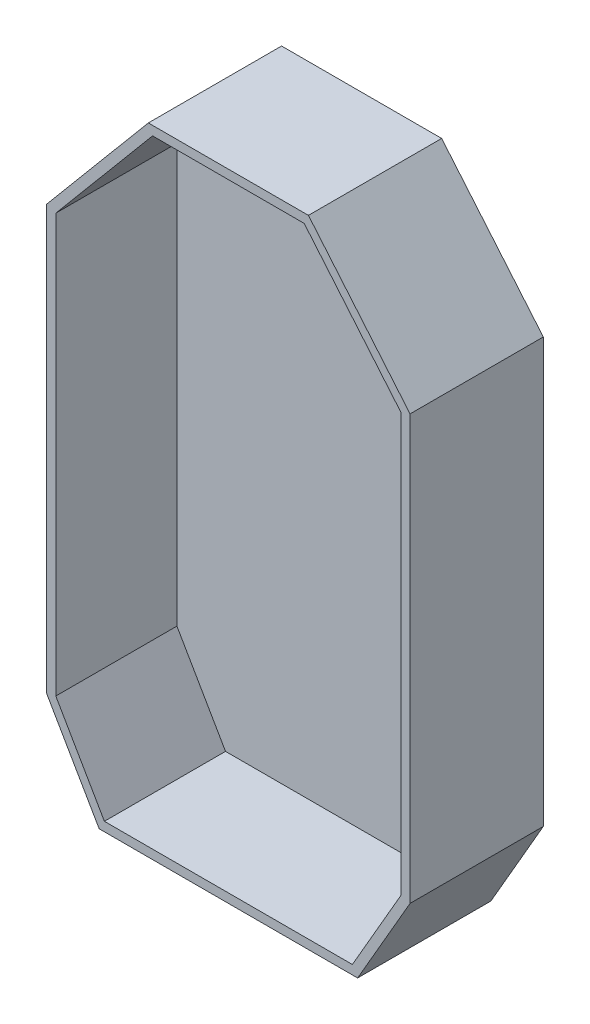
from build123d import *

# Parameters (mm, degrees)
BOSS_EXTRUDE1_DEPTH = 4
BOSS_EXTRUDE2_DEPTH = 40


with BuildPart() as part:
    # Sketch1 → Boss-Extrude1 (new body)
    with BuildSketch(Plane.XY):
        Polygon((-60, 70), (-26.436014753, 110), (26.436014753, 110), (60, 70), (60, -70), (42.679491924, -100), (-42.679491924, -100), (-60, -70), align=None)
    extrude(amount=BOSS_EXTRUDE1_DEPTH)

    # Sketch2 → Boss-Extrude2 (add)
    with BuildSketch(Plane.XY.offset(4)):
        Polygon((-26.436014753, 110), (-60, 70), (-60, -70), (-42.679491924, -100), (42.679491924, -100), (60, -70), (60, 70), (26.436014753, 110), align=None)
        Polygon((-25.037091778, 107), (-57, 68.908089297), (-57, -69.196152423), (-40.947441117, -97), (40.947441117, -97), (57, -69.196152423), (57, 68.908089297), (25.037091778, 107), align=None, mode=Mode.SUBTRACT)
    extrude(amount=BOSS_EXTRUDE2_DEPTH)


solid = part.part
